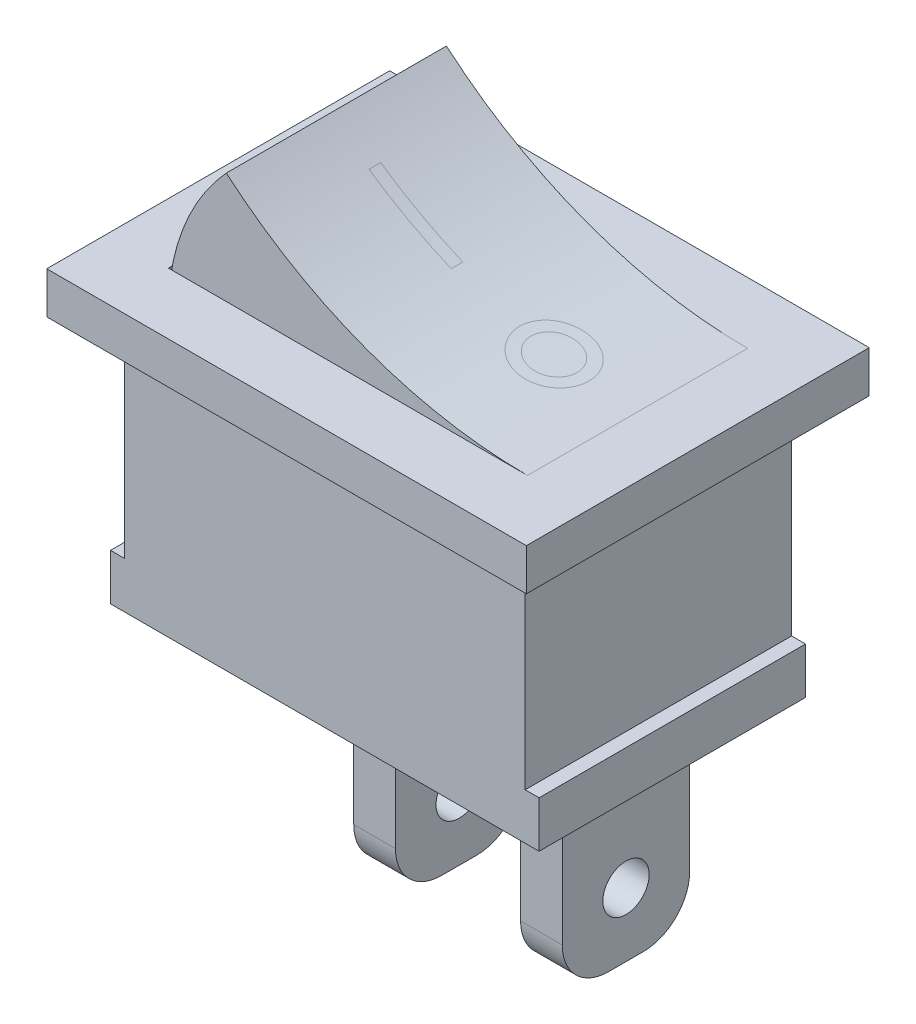
from build123d import *

# Parameters (mm, degrees)
SALIENTE_EXTRUIR1_DEPTH             = 5.75
CROQUIS2_W                          = 20.7
CROQUIS2_H                          = 14.8
SALIENTE_EXTRUIR2_DEPTH             = 1.8
CROQUIS3_W                          = 15.5
CROQUIS3_H                          = 9.5
CORTAR_EXTRUIR1_DEPTH               = 1.8
SALIENTE_EXTRUIR3_REACH             = 16.287
SALIENTE_EXTRUIR3_DIRECTION_2_REACH = 16.287
CROQUIS7_W                          = 1.8
CROQUIS7_H                          = 8
SALIENTE_EXTRUIR4_DEPTH             = 2.75
SALIENTE_EXTRUIR4_2_DEPTH           = 2.75
REDONDEO1_R                         = 2
REDONDEO2_R                         = 2
CROQUIS9_R                          = 1
CORTAR_EXTRUIR2_DEPTH               = 24.974361305


with BuildPart() as part:
    # Croquis1 → Saliente-Extruir1 (new, symmetric)
    with BuildSketch(Plane.XY):
        Polygon((8.65, -4.5), (9.25, -4.5), (9.25, -6.5), (-9.25, -6.5), (-9.25, -4.5), (-8.65, -4.5), (-8.65, 4.5), (8.65, 4.5), align=None)
    extrude(amount=SALIENTE_EXTRUIR1_DEPTH, both=True)

    # Croquis2 → Saliente-Extruir2 (add)
    with BuildSketch(Plane(origin=(0, 4.5, 0), x_dir=(1, 0, 0), z_dir=(0, 1, 0))):
        Rectangle(CROQUIS2_W, CROQUIS2_H)
    extrude(amount=SALIENTE_EXTRUIR2_DEPTH)

    # Croquis3 → Cortar-Extruir1 (cut)
    with BuildSketch(Plane(origin=(0, 6.3, 0), x_dir=(1, 0, 0), z_dir=(0, 1, 0))):
        Rectangle(CROQUIS3_W, CROQUIS3_H)
    extrude(amount=-CORTAR_EXTRUIR1_DEPTH, mode=Mode.SUBTRACT)


with BuildPart() as body_2:

    # Saliente-Extruir3: up to this face of the body (flat: up to its plane)
    saliente_extruir3_end = Plane(part.part.faces().sort_by_distance((0, 5.4, 4.75))[0])
    # Croquis4 → Saliente-Extruir3 (new, up to the picked face)
    with BuildSketch(Plane.XY, mode=Mode.PRIVATE) as saliente_extruir3_sk1:
        with BuildLine():
            Line((7.75, 4.5), (-7.75, 4.5))
            ThreePointArc((-7.75, 4.5), (-7.13588418, 8.041475131), (-5.25, 11.101315846))
            ThreePointArc((-5.25, 11.101315846), (0.820847204, 7.538687638), (7.75, 6.3))
            Line((7.75, 6.3), (7.75, 4.5))
        make_face()
    saliente_extruir3_tool1 = split(extrude(saliente_extruir3_sk1.sketch, amount=SALIENTE_EXTRUIR3_REACH, mode=Mode.PRIVATE), bisect_by=saliente_extruir3_end, keep=Keep.BOTH, mode=Mode.PRIVATE)
    add(saliente_extruir3_tool1.solids().sort_by(Axis((-1.534706, 6.575986, 0), (0, 0, 1)))[0])


    # Saliente-Extruir3 direction 2: up to this face of the body (flat: up to its plane)
    saliente_extruir3_direction_2_end = Plane(part.part.faces().sort_by_distance((0, 5.4, -4.75))[0])
    # Croquis4 → Saliente-Extruir3 direction 2 (add, up to the picked face)
    with BuildSketch(Plane.XY, mode=Mode.PRIVATE) as saliente_extruir3_direction_2_sk1:
        with BuildLine():
            Line((7.75, 4.5), (-7.75, 4.5))
            ThreePointArc((-7.75, 4.5), (-7.13588418, 8.041475131), (-5.25, 11.101315846))
            ThreePointArc((-5.25, 11.101315846), (0.820847204, 7.538687638), (7.75, 6.3))
            Line((7.75, 6.3), (7.75, 4.5))
        make_face()
    saliente_extruir3_direction_2_tool1 = split(extrude(saliente_extruir3_direction_2_sk1.sketch, amount=-SALIENTE_EXTRUIR3_DIRECTION_2_REACH, mode=Mode.PRIVATE), bisect_by=saliente_extruir3_direction_2_end, keep=Keep.BOTH, mode=Mode.PRIVATE)
    add(saliente_extruir3_direction_2_tool1.solids().sort_by(Axis((-1.534706, 6.575986, 0), (0, 0, -1)))[0])


with BuildPart() as body_3:
    # Croquis7 → Saliente-Extruir4 (new, symmetric)
    with BuildSketch(Plane.XY):
        with Locations((6.35, -10.5)):
            Rectangle(CROQUIS7_W, CROQUIS7_H)
    extrude(amount=SALIENTE_EXTRUIR4_DEPTH, both=True)

    # Redondeo2
    redondeo2_edges = [body_3.edges().sort_by_distance(p)[0] for p in [
        (6.35, -14.5, -2.75),
        (6.35, -14.5, 2.75),
    ]]
    fillet(redondeo2_edges, radius=REDONDEO2_R)


with BuildPart() as body_4:
    # Croquis7 → Saliente-Extruir4 2 (new, symmetric)
    with BuildSketch(Plane.XY):
        with Locations((-0.85, -10.5)):
            Rectangle(CROQUIS7_W, CROQUIS7_H)
    extrude(amount=SALIENTE_EXTRUIR4_2_DEPTH, both=True)

    # Redondeo1
    redondeo1_edges = [body_4.edges().sort_by_distance(p)[0] for p in [
        (-0.85, -14.5, 2.75),
        (-0.85, -14.5, -2.75),
    ]]
    fillet(redondeo1_edges, radius=REDONDEO1_R)


with BuildPart() as cortar_extruir2_tool:
    # Croquis9 → Cortar-Extruir2 (new, through all)
    with BuildSketch(Plane(origin=(7.25, 0, 0), x_dir=(0, 0, -1), z_dir=(1, 0, 0))):
        with Locations(Location((0, -11.739625203, 0), (0, 0, 90))):
            Circle(CROQUIS9_R)
    extrude(amount=-CORTAR_EXTRUIR2_DEPTH)


with BuildPart() as body_3_1:
    add(body_3.part)

    # Cortar-Extruir2: cut by cortar_extruir2_tool
    add(cortar_extruir2_tool.part, mode=Mode.SUBTRACT)


with BuildPart() as body_4_1:
    add(body_4.part)

    # Cortar-Extruir2: cut by cortar_extruir2_tool
    add(cortar_extruir2_tool.part, mode=Mode.SUBTRACT)


solid = Compound([part.part, body_2.part, body_3_1.part, body_4_1.part])
